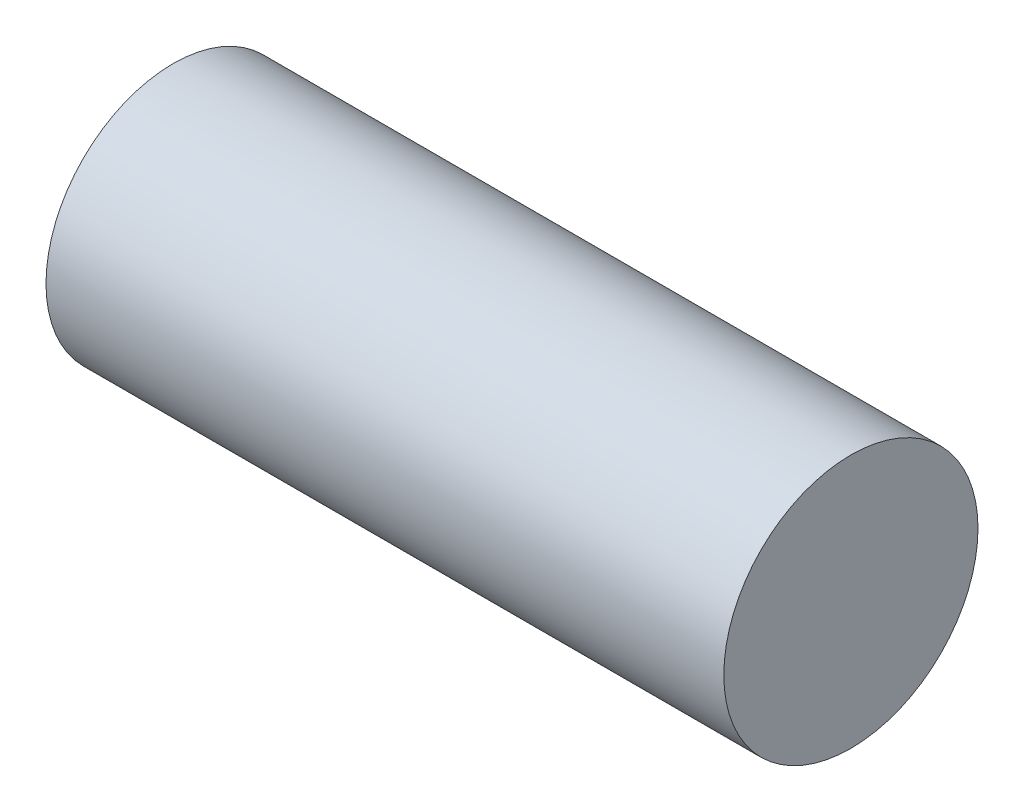
from build123d import *


with BuildPart() as part:
    # ｽｹｯﾁ2 → 回転1 (revolve)
    with BuildSketch(Plane.XY, mode=Mode.PRIVATE) as revolve_1_sk:
        Polygon((10, 0), (0, 0), (0, -60), (160, -60), (160, -10), (150, -10), (110, -50), (10, -50), align=None)
        Polygon((160, -10), (160, -60), (320, -60), (320, 0), (310, 0), (310, -50), (210, -50), (170, -10), align=None)
    revolve(revolve_1_sk.sketch.rotate(Axis((10, 0, 0), (-1, 0, 0)), 180), axis=Axis((10, 0, 0), (-1, 0, 0)))


solid = part.part
